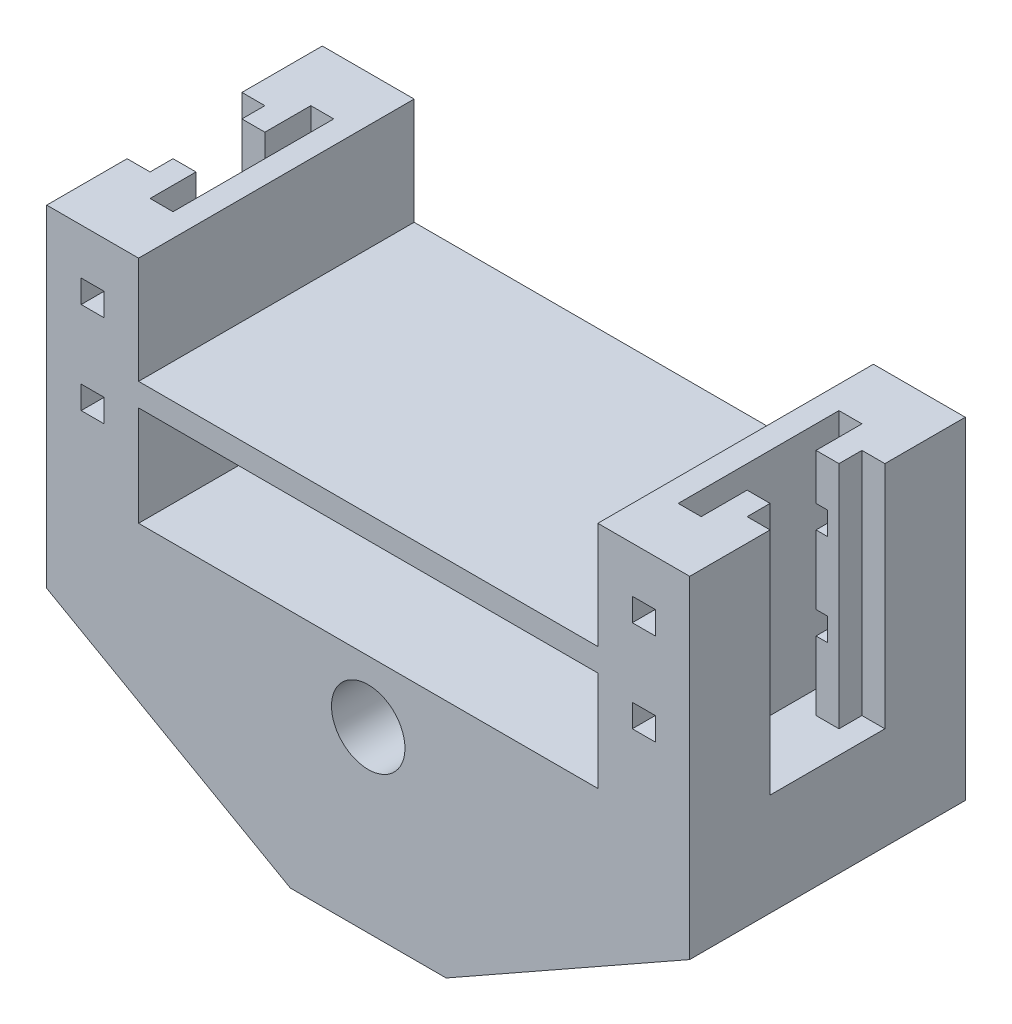
from build123d import *

# Parameters (mm, degrees)
BOSS_EXTRUDE2_DEPTH            = 30
BOSS_EXTRUDE2_DEPTH_BACK       = 30
EXTRUDE_THIN2_DEPTH            = 25
EXTRUDE_THIN2_DEPTH_BACK       = 25
SKETCH2_W                      = 60
SKETCH2_H                      = 5
BOSS_EXTRUDE3_DEPTH            = 100
BOSS_EXTRUDE4_DEPTH            = 30
BOSS_EXTRUDE4_DEPTH_BACK       = 30
CUT_EXTRUDE2_REACH             = 143.361
SKETCH4_W                      = 60
SKETCH4_H                      = 5
CUT_EXTRUDE2_DIRECTION_2_REACH = 143.361
BOSS_EXTRUDE5_DEPTH            = 30
BOSS_EXTRUDE5_DEPTH_BACK       = 30
DRONE_ARM_FIT_CUT_DEPTH        = 50
CUT_EXTRUDE3_START             = -60
SKETCH8_W                      = 5
SKETCH8_H                      = 5
CUT_EXTRUDE3_DEPTH             = 60


with BuildPart() as part:
    # Sketch1 → Boss-Extrude2 (new, two sides: drawn at the far end of the back side and taken through both)
    with BuildSketch(Plane.XY.offset(-BOSS_EXTRUDE2_DEPTH_BACK)):
        Polygon((-13.01396445, -23.830717844), (0, -23.830717844), (0, -18.830717844), (-11.698214449, -18.830717844), (-50, 2.827283512), (-50, 13.432214294), (-55, 13.432214294), (-55, -0.089432632), align=None)
        Polygon((0, -18.830717844), (0, -23.830717844), (13.01396445, -23.830717844), (55, -0.089432632), (55, 13.432214294), (50, 13.432214294), (50, 2.827283512), (11.698214449, -18.830717844), align=None)
        with BuildLine():
            Line((-11.698214449, -18.830717844), (0, -18.830717844))
            Line((0, -18.830717844), (0, -8))
            ThreePointArc((0, -8), (-8, 0), (0, 8))
            Line((0, 8), (0, 13.432214294))
            Line((0, 13.432214294), (-50, 13.432214294))
            Line((-50, 13.432214294), (-50, 2.827283512))
            Line((-50, 2.827283512), (-11.698214449, -18.830717844))
        make_face()
        with BuildLine():
            Line((0, -8), (0, -18.830717844))
            Line((0, -18.830717844), (11.698214449, -18.830717844))
            Line((11.698214449, -18.830717844), (50, 2.827283512))
            Line((50, 2.827283512), (50, 13.432214294))
            Line((50, 13.432214294), (0, 13.432214294))
            Line((0, 13.432214294), (0, 8))
            ThreePointArc((0, 8), (5.656854249, 5.656854249), (8, 0))
            ThreePointArc((8, 0), (5.656854249, -5.656854249), (0, -8))
        make_face()
    extrude(amount=BOSS_EXTRUDE2_DEPTH + BOSS_EXTRUDE2_DEPTH_BACK)

    # Sketch1<5> → Extrude-Thin2 (add, two sides: drawn at the far end of the back side and taken through both)
    with BuildSketch(Plane.XY.offset(-EXTRUDE_THIN2_DEPTH_BACK)):
        Polygon((50, 13.432214294), (50, 38.432214294), (50, 63.432214294), (-50, 63.432214294), (-50, 38.432214294), (-50, 13.432214294), (-55, 13.432214294), (-55, 38.432214294), (-55, 68.432214294), (55, 68.432214294), (55, 38.432214294), (55, 13.432214294), align=None)
    extrude(amount=EXTRUDE_THIN2_DEPTH + EXTRUDE_THIN2_DEPTH_BACK)

    # Sketch2 → Boss-Extrude3 (add)
    with BuildSketch(Plane.ZY.offset(-50)):
        with Locations((0, 37.694873029)):
            Rectangle(SKETCH2_W, SKETCH2_H)
    extrude(amount=BOSS_EXTRUDE3_DEPTH)

    # Sketch1<6> → Boss-Extrude4 (add, two sides: drawn at the far end of the back side and taken through both)
    with BuildSketch(Plane.XY.offset(-BOSS_EXTRUDE4_DEPTH_BACK)):
        Polygon((-55, -0.089432632), (-55, 13.432214294), (-70, 13.432214294), (-70, -8.839581066), (-16.961214453, -38.830717844), (16.961214453, -38.830717844), (70, -8.839581066), (70, 13.432214294), (55, 13.432214294), (55, -0.089432632), (13.01396445, -23.830717844), (-13.01396445, -23.830717844), align=None)
    extrude(amount=BOSS_EXTRUDE4_DEPTH + BOSS_EXTRUDE4_DEPTH_BACK)

    # Cut-Extrude2: up to this face of the body (flat: up to its plane)
    cut_extrude2_end = Plane(part.part.faces().sort_by_distance((-55, 40.932214294, 0))[0])
    # Sketch4 → Cut-Extrude2 (cut, up to the picked face)
    with BuildSketch(Plane(origin=(-50, 0, 0), x_dir=(0, 0, -1), z_dir=(1, 0, 0)), mode=Mode.PRIVATE) as cut_extrude2_sk1:
        with Locations((0, 65.932214294)):
            Rectangle(SKETCH4_W, SKETCH4_H)
    cut_extrude2_tool1 = split(extrude(cut_extrude2_sk1.sketch, amount=-CUT_EXTRUDE2_REACH, mode=Mode.PRIVATE), bisect_by=cut_extrude2_end, keep=Keep.BOTH, mode=Mode.PRIVATE)
    add(cut_extrude2_tool1.solids().sort_by(Axis((-50, 65.932214, 0), (-1, 0, 0)))[0], mode=Mode.SUBTRACT)

    # Cut-Extrude2 direction 2: up to this face of the body (flat: up to its plane)
    cut_extrude2_direction_2_end = Plane(part.part.faces().sort_by_distance((55, 40.932214294, 0))[0])
    # Sketch4 → Cut-Extrude2 direction 2 (cut, up to the picked face)
    with BuildSketch(Plane(origin=(-50, 0, 0), x_dir=(0, 0, -1), z_dir=(1, 0, 0)), mode=Mode.PRIVATE) as cut_extrude2_direction_2_sk1:
        with Locations((0, 65.932214294)):
            Rectangle(SKETCH4_W, SKETCH4_H)
    cut_extrude2_direction_2_tool1 = split(extrude(cut_extrude2_direction_2_sk1.sketch, amount=CUT_EXTRUDE2_DIRECTION_2_REACH, mode=Mode.PRIVATE), bisect_by=cut_extrude2_direction_2_end, keep=Keep.BOTH, mode=Mode.PRIVATE)
    add(cut_extrude2_direction_2_tool1.solids().sort_by(Axis((-50, 65.932214, 0), (1, 0, 0)))[0], mode=Mode.SUBTRACT)

    # Sketch1<7> → Boss-Extrude5 (add, two sides: drawn at the far end of the back side and taken through both)
    with BuildSketch(Plane.XY.offset(-BOSS_EXTRUDE5_DEPTH_BACK)):
        Polygon((-70, 13.432214294), (-55, 13.432214294), (-50, 13.432214294), (-50, 38.432214294), (-50, 63.432214294), (-70, 63.432214294), (-70, 38.432214294), align=None)
        Polygon((50, 38.432214294), (50, 13.432214294), (55, 13.432214294), (70, 13.432214294), (70, 38.432214294), (70, 63.432214294), (50, 63.432214294), align=None)
    extrude(amount=BOSS_EXTRUDE5_DEPTH + BOSS_EXTRUDE5_DEPTH_BACK)

    # Sketch7 → Drone Arm fit cut (cut)
    with BuildSketch(Plane(origin=(0, 63.432214294, 0), x_dir=(1, 0, 0), z_dir=(0, 1, 0))):
        Polygon((-70, -12.5), (-70, 12.5), (-65, 12.5), (-65, 7.5), (-60, 7.5), (-60, 12.5), (-60, 17.5), (-55, 17.5), (-55, -17.5), (-60, -17.5), (-60, -12.5), (-60, -7.5), (-65, -7.5), (-65, -12.5), align=None)
    drone_arm_fit_cut = extrude(amount=-DRONE_ARM_FIT_CUT_DEPTH, mode=Mode.SUBTRACT)

    # Mirror Drone arm fit cut: Drone Arm fit cut across plane
    add(drone_arm_fit_cut.mirror(Plane(origin=(0, 0, 0), x_dir=(0, 0, 1), z_dir=(1, 0, 0))), mode=Mode.SUBTRACT)

    # Sketch8 → Cut-Extrude3 (cut)
    with BuildSketch(Plane.XY.offset(30).offset(CUT_EXTRUDE3_START)):
        with Locations((-60, 50.932214294)):
            Rectangle(SKETCH8_W, SKETCH8_H)
        with Locations((-60, 30.932214294)):
            Rectangle(SKETCH8_W, SKETCH8_H)
    cut_extrude3 = extrude(amount=CUT_EXTRUDE3_DEPTH, mode=Mode.SUBTRACT)

    # Mirror1: Cut-Extrude3 across plane
    add(cut_extrude3.mirror(Plane(origin=(0, 0, 0), x_dir=(0, 0, 1), z_dir=(1, 0, 0))), mode=Mode.SUBTRACT)


solid = part.part
